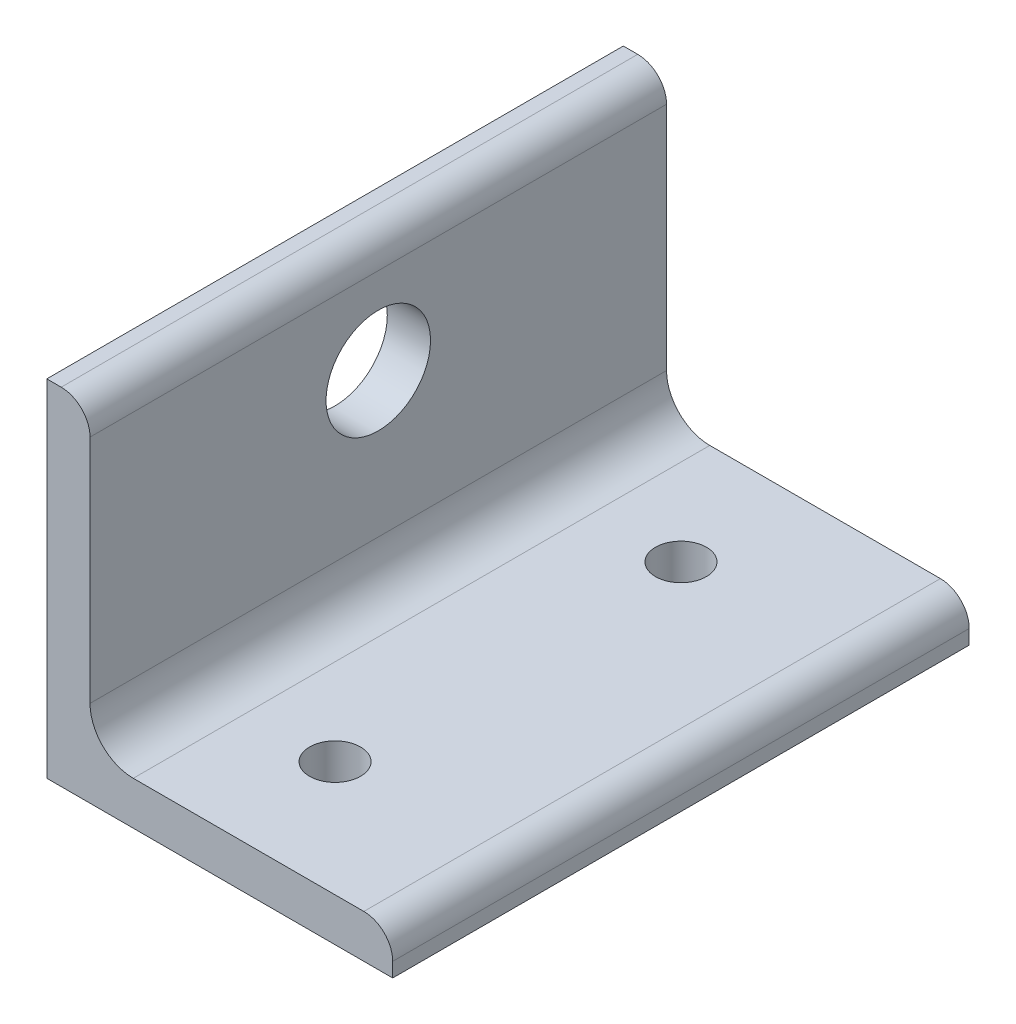
from build123d import *

# Parameters (mm, degrees)
EXTRUDE1_DEPTH           = 63.5
F_10_CLEARANCE_HOLE1_D   = 5.6134
F_7_16_CLEARANCE_HOLE1_D = 11.50874


with BuildPart() as part:
    # Sketch1 → Extrude1 (new body)
    with BuildSketch(Plane.XY):
        with BuildLine():
            Line((0, 0), (0, 38.1))
            Line((0, 38.1), (1.5875, 38.1))
            ThreePointArc((1.5875, 38.1), (3.83256403, 37.17006403), (4.7625, 34.925))
            Line((4.7625, 34.925), (4.7625, 9.525))
            ThreePointArc((4.7625, 9.525), (6.157403955, 6.157403955), (9.525, 4.7625))
            Line((9.525, 4.7625), (34.925, 4.7625))
            ThreePointArc((34.925, 4.7625), (37.17006403, 3.83256403), (38.1, 1.5875))
            Line((38.1, 1.5875), (38.1, 0))
            Line((38.1, 0), (0, 0))
        make_face()
    extrude(amount=EXTRUDE1_DEPTH)

    # #10 Clearance Hole1 (through all)
    with Locations(Plane(origin=(0, 4.7625, 0), x_dir=(-1, 0, 0), z_dir=(0, 1, 0))):
        with Locations((-19.05, 50.8), (-19.05, 12.7)):
            Hole(F_10_CLEARANCE_HOLE1_D / 2)

    # 7/16 Clearance Hole1 (through all)
    with Locations(Plane(origin=(4.7625, 0, 0), x_dir=(0, 0, -1), z_dir=(1, 0, 0))):
        with Locations((-31.75, 25.4)):
            Hole(F_7_16_CLEARANCE_HOLE1_D / 2)


solid = part.part
